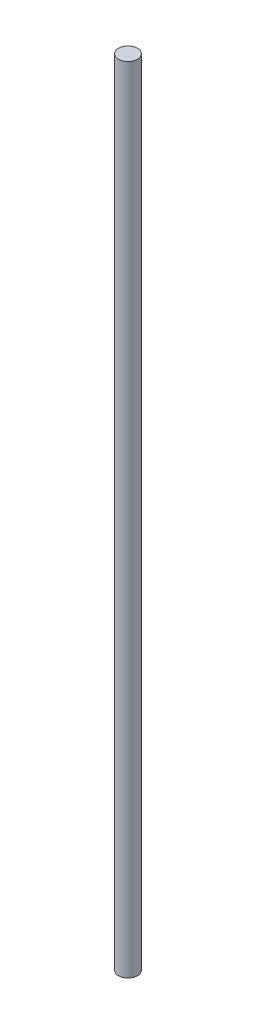
from build123d import *

# Parameters (mm, degrees)
SKETCH_1_R      = 3
EXTRUDE_1_DEPTH = 250


with BuildPart() as part:
    # 草图1 → 凸台-拉伸1 (new body)
    with BuildSketch(Plane(origin=(0, 0, 0), x_dir=(1, 0, 0), z_dir=(0, 1, 0))):
        with Locations(Location((0, 0, 0), (0, 0, 270))):
            Circle(SKETCH_1_R)
    extrude(amount=EXTRUDE_1_DEPTH)


solid = part.part
